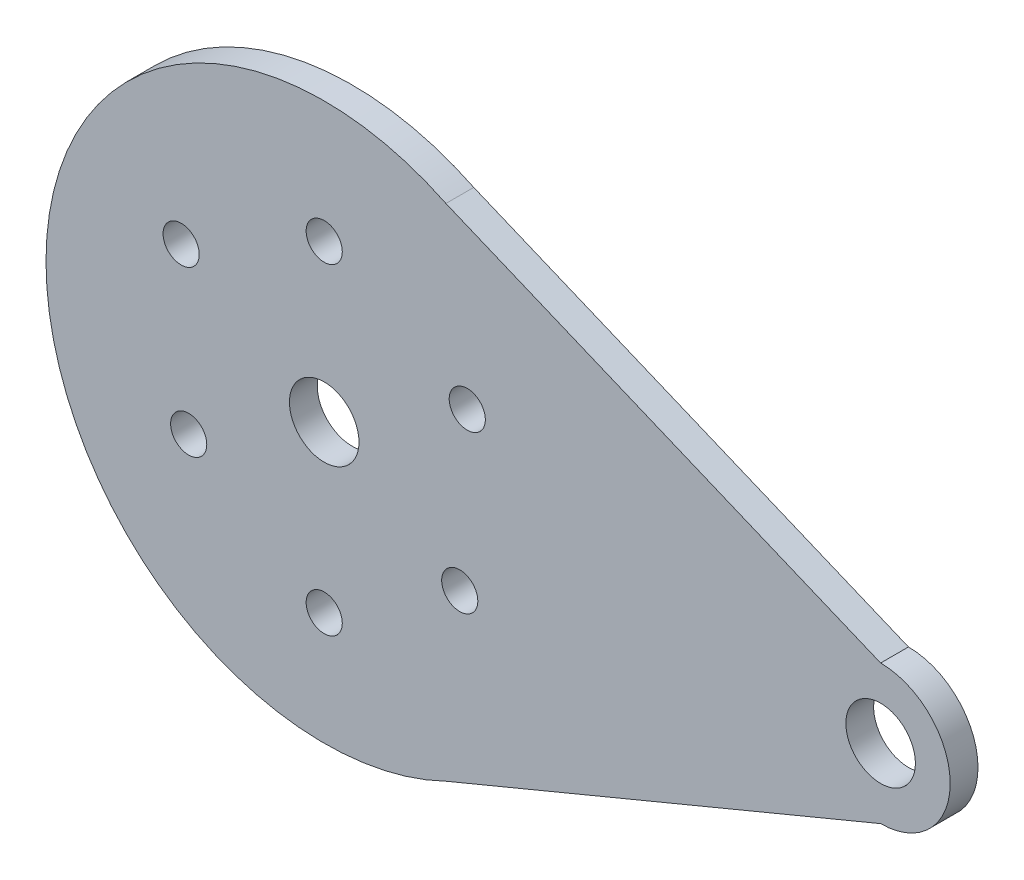
from build123d import *

# Parameters (mm, degrees)
SKETCH_2_R      = 2.6
SKETCH_2_R_2    = 5
EXTRUDE_1_DEPTH = 4


with BuildPart() as part:
    # 草图2 → 凸台-拉伸1 (new body)
    with BuildSketch(Plane.XY):
        with BuildLine():
            Line((17.886574367, 34.937240644), (80.386574367, 8.968504219))
            ThreePointArc((80.386574367, 8.968504219), (90.386574367, -1.031495781), (80.386574367, -11.031495781))
            Line((80.386574367, -11.031495781), (17.886574367, -37.000232206))
            ThreePointArc((17.886574367, -37.000232206), (-39.613425633, -1.031495781), (17.886574367, 34.937240644))
        make_face()
        with Locations((0.386574367, -24.781495781)):
            Circle(SKETCH_2_R, mode=Mode.SUBTRACT)
        with Locations((19.872145952, -12.281495781)):
            Circle(SKETCH_2_R, mode=Mode.SUBTRACT)
        with Locations((0.386574367, -1.031495781)):
            Circle(SKETCH_2_R_2, mode=Mode.SUBTRACT)
        with Locations((-20.181528973, 10.843504219)):
            Circle(SKETCH_2_R, mode=Mode.SUBTRACT)
        with Locations((20.954677707, 10.843504219)):
            Circle(SKETCH_2_R, mode=Mode.SUBTRACT)
        with Locations((-19.098997218, -12.281495781)):
            Circle(SKETCH_2_R, mode=Mode.SUBTRACT)
        with Locations((0.386574367, 21.468504219)):
            Circle(SKETCH_2_R, mode=Mode.SUBTRACT)
        with Locations((80.386574367, -1.031495781)):
            Circle(SKETCH_2_R_2, mode=Mode.SUBTRACT)
    extrude(amount=EXTRUDE_1_DEPTH)


solid = part.part
